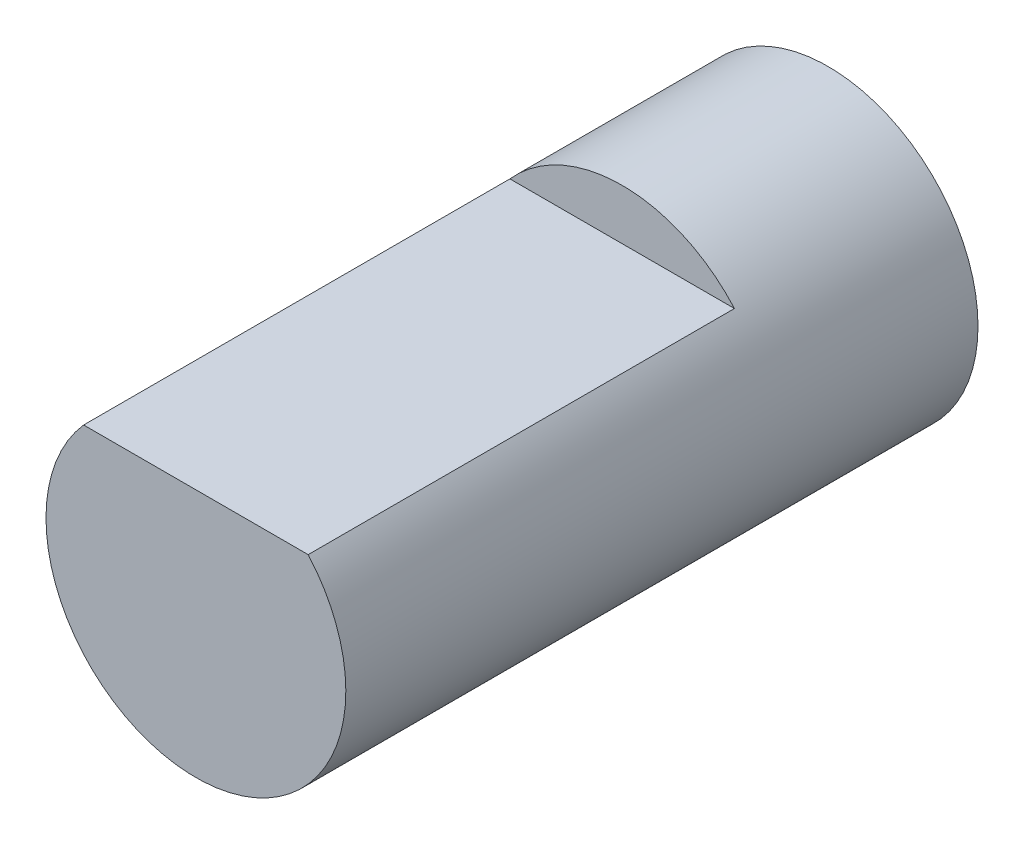
from build123d import *

# Parameters (mm, degrees)
SKETCH1_R           = 4.15
BOSS_EXTRUDE1_DEPTH = 17.5
CUT_EXTRUDE2_DEPTH  = 11.8


with BuildPart() as part:
    # Sketch1 → Boss-Extrude1 (new body)
    with BuildSketch(Plane.XY):
        Circle(SKETCH1_R)
    extrude(amount=BOSS_EXTRUDE1_DEPTH)

    # Sketch3 → Cut-Extrude2 (cut)
    with BuildSketch(Plane.XY.offset(17.5)):
        Polygon((-2.257372241, 2.75), (5.403828273, 2.75), (5.403828273, 6.178991051), (-6.344388295, 6.178991051), (-6.344388295, 2.75), align=None)
    extrude(amount=-CUT_EXTRUDE2_DEPTH, mode=Mode.SUBTRACT)


solid = part.part
